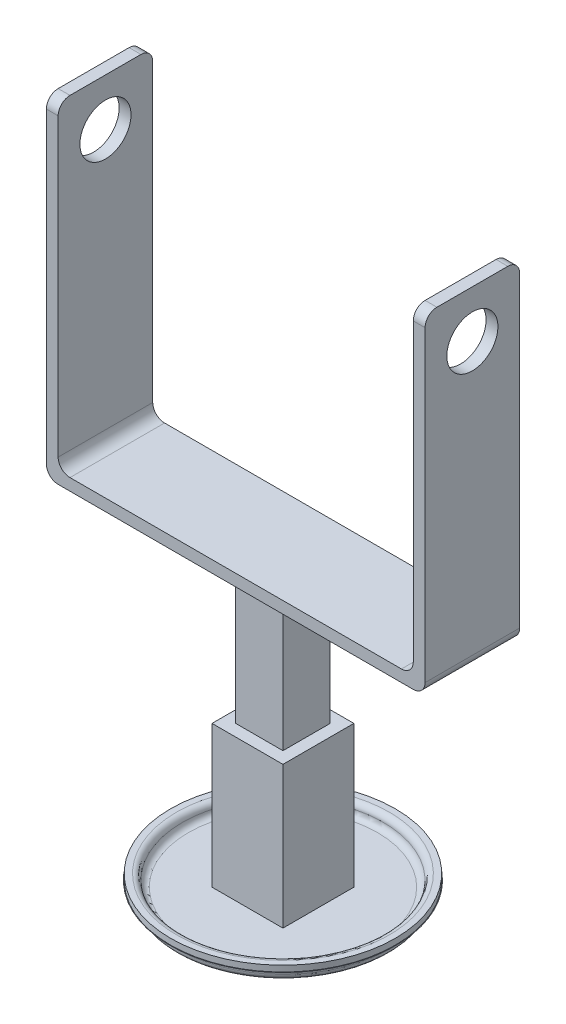
from build123d import *

# Parameters (mm, degrees)
SKETCH3_W           = 38.1
SKETCH3_H           = 38.1
BOSS_EXTRUDE1_DEPTH = 76.2
SKETCH4_W           = 25.4
SKETCH4_H           = 25.4
BOSS_EXTRUDE2_DEPTH = 76.2
BOSS_EXTRUDE3_DEPTH = 25.4
FILLET1_R           = 6.35
FILLET2_R           = 6.35
FILLET3_R           = 6.35
FILLET4_R           = 6.35
SKETCH6_R           = 13.716
CUT_EXTRUDE1_DEPTH  = 396.229298103


with BuildPart() as part:
    # Sketch2 → Revolve1 (revolve)
    with BuildSketch(Plane.XY, mode=Mode.PRIVATE) as revolve1_sk:
        with BuildLine():
            Line((0, 0), (54.261693079, 0))
            ThreePointArc((54.261693079, 0), (56.506757109, 0.92993597), (57.436693079, 3.175))
            ThreePointArc((57.436693079, 3.175), (58.366629049, 5.42006403), (60.611693079, 6.35))
            Line((60.611693079, 6.35), (60.325, 6.35))
            Line((60.325, 6.35), (60.325, 9.525))
            Line((60.325, 9.525), (57.15, 9.525))
            ThreePointArc((57.15, 9.525), (54.90493597, 8.59506403), (53.975, 6.35))
            ThreePointArc((53.975, 6.35), (53.04506403, 4.10493597), (50.8, 3.175))
            Line((50.8, 3.175), (0, 3.175))
            Line((0, 3.175), (0, 0))
        make_face()
    revolve(revolve1_sk.sketch.rotate(Axis((0, 3.175, 0), (0, -1, 0)), 180), axis=Axis((0, 3.175, 0), (0, -1, 0)))

    # Sketch3 → Boss-Extrude1 (add)
    with BuildSketch(Plane(origin=(0, 3.175, 0), x_dir=(1, 0, 0), z_dir=(0, 1, 0))):
        Rectangle(SKETCH3_W, SKETCH3_H)
    extrude(amount=BOSS_EXTRUDE1_DEPTH)

    # Sketch4 → Boss-Extrude2 (add)
    with BuildSketch(Plane(origin=(0, 79.375, 0), x_dir=(1, 0, 0), z_dir=(0, 1, 0))):
        Rectangle(SKETCH4_W, SKETCH4_H)
    extrude(amount=BOSS_EXTRUDE2_DEPTH)

    # Sketch5 → Boss-Extrude3 (add, symmetric)
    with BuildSketch(Plane.XY):
        Polygon((101.754471665, 155.575), (-101.699528335, 155.575), (-101.699528335, 333.375), (-95.349528335, 333.375), (-95.349528335, 161.925), (95.404471665, 161.925), (95.404471665, 333.375), (101.754471665, 333.375), align=None)
    extrude(amount=BOSS_EXTRUDE3_DEPTH, both=True)

    # Fillet1
    fillet1_edges = [part.edges().sort_by_distance(p)[0] for p in [
        (95.404471665, 161.925, 0),
    ]]
    fillet(fillet1_edges, radius=FILLET1_R)

    # Fillet2
    fillet2_edges = [part.edges().sort_by_distance(p)[0] for p in [
        (-95.349528335, 161.925, 0),
    ]]
    fillet(fillet2_edges, radius=FILLET2_R)

    # Fillet3
    fillet3_edges = [part.edges().sort_by_distance(p)[0] for p in [
        (-101.699528335, 155.575, 0),
        (101.754471665, 155.575, 0),
    ]]
    fillet(fillet3_edges, radius=FILLET3_R)

    # Fillet4
    fillet4_edges = [part.edges().sort_by_distance(p)[0] for p in [
        (-98.524528335, 333.375, -25.4),
        (98.579471665, 333.375, -25.4),
        (-98.524528335, 333.375, 25.4),
        (98.579471665, 333.375, 25.4),
    ]]
    fillet(fillet4_edges, radius=FILLET4_R)

    # Sketch6 → Cut-Extrude1 (cut, through all)
    with BuildSketch(Plane(origin=(101.754471665, 0, 0), x_dir=(0, 0, -1), z_dir=(1, 0, 0))):
        with Locations((0, 307.975)):
            Circle(SKETCH6_R)
    extrude(amount=-CUT_EXTRUDE1_DEPTH, mode=Mode.SUBTRACT)


solid = part.part
